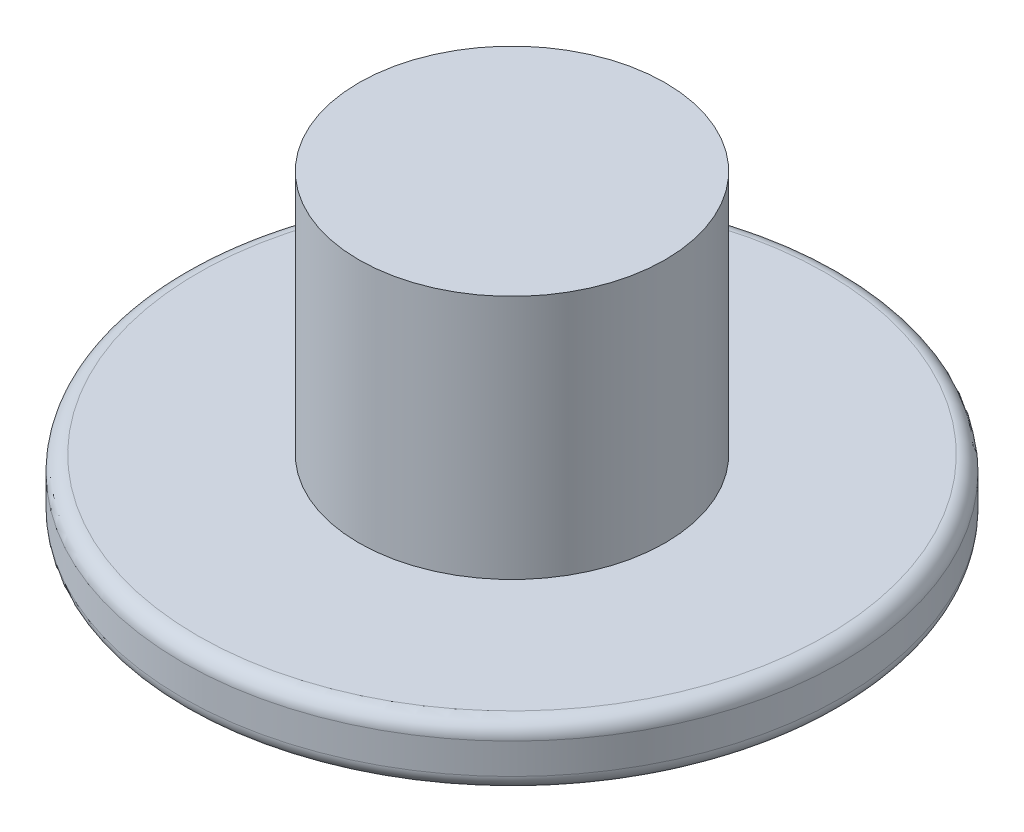
from build123d import *

# Parameters (mm, degrees)
SKETCH1_R           = 10.75
BOSS_EXTRUDE5_DEPTH = 2
SKETCH4_R           = 5
BOSS_EXTRUDE6_DEPTH = 8
CUT_EXTRUDE2_DEPTH  = 0.5
FILLET1_R           = 0.5


with BuildPart() as part:
    # Sketch1 → Boss-Extrude5 (new body)
    with BuildSketch(Plane(origin=(0, 0, 0), x_dir=(1, 0, 0), z_dir=(0, 1, 0))):
        with Locations(Location((-5.408676197, -40.3067379, 0), (0, 0, 270))):
            Circle(SKETCH1_R)
    extrude(amount=BOSS_EXTRUDE5_DEPTH)

    # Sketch4 → Boss-Extrude6 (add)
    with BuildSketch(Plane(origin=(0, 2, 0), x_dir=(1, 0, 0), z_dir=(0, 1, 0))):
        with Locations(Location((-5.408676197, -40.3067379, 0), (0, 0, 270))):
            Circle(SKETCH4_R)
    extrude(amount=BOSS_EXTRUDE6_DEPTH)

    # Sketch5 → Cut-Extrude2 (cut)
    with BuildSketch(Plane.XZ):
        with BuildLine():
            Line((-1.119213117, 44.837068706), (-1.119213117, 43.683222552))
            Line((-1.119213117, 43.683222552), (-5.343972733, 43.683222552))
            Line((-5.343972733, 43.683222552), (-6.023059271, 41.293398834))
            add(Edge.make_bspline(
                [(-6.023059271, 41.293398834), (-5.932156571, 41.326006682), (-5.748327994, 41.391948115), (-5.457355976, 41.457073381), (-5.152680183, 41.494921804), (-4.944776832, 41.500766404), (-4.83916504, 41.503735373)],
                knots=[0, 0, 0, 0, 0.957717051, 1.936749544, 2.951899637, 4, 4, 4, 4], degree=3))
            add(Edge.make_bspline(
                [(-4.83916504, 41.503735373), (-4.692794844, 41.501511705), (-4.405302434, 41.497144096), (-3.984914685, 41.449022779), (-3.584114393, 41.376035058), (-3.203409576, 41.272428706), (-2.84410494, 41.134960143), (-2.503422249, 40.970833678), (-2.183430631, 40.775504615), (-1.886735045, 40.552203964), (-1.617614167, 40.307560211), (-1.380562504, 40.046212071), (-1.18207178, 39.768708327), (-1.016586663, 39.477477761), (-0.89101931, 39.170105093), (-0.800035696, 38.848376848), (-0.744603566, 38.51220008), (-0.73796564, 38.282791456), (-0.734597733, 38.166395629)],
                knots=[0, 0, 0, 0, 1.189422793, 2.336199813, 3.434961192, 4.499048693, 5.538481089, 6.55816476, 7.569214574, 8.581065566, 9.572455183, 10.521863525, 11.44380993, 12.340676557, 13.23887286, 14.135887326, 15.054198869, 16, 16, 16, 16], degree=3))
            add(Edge.make_bspline(
                [(-0.734597733, 38.166395629), (-0.736640177, 38.085517838), (-0.740703434, 37.924618805), (-0.769785303, 37.68553966), (-0.815472566, 37.451064567), (-0.880132404, 37.220499767), (-0.964125821, 36.994808543), (-1.06783674, 36.773146693), (-1.187054465, 36.554434869), (-1.327713423, 36.342988535), (-1.484068604, 36.139863296), (-1.651274877, 35.943889885), (-1.836982388, 35.763848397), (-2.036297248, 35.595294519), (-2.247651639, 35.436933598), (-2.474538943, 35.29216457), (-2.713969847, 35.157576429), (-2.969100544, 35.038319676), (-3.234502949, 34.930569363), (-3.510180209, 34.835095329), (-3.796371201, 34.758164461), (-4.092034227, 34.694367722), (-4.396528465, 34.641310625), (-4.710907901, 34.605736687), (-5.035226874, 34.586116093), (-5.254470616, 34.582498734), (-5.366007989, 34.58065845)],
                knots=[0, 0, 0, 0, 0.892114965, 1.774781853, 2.653165494, 3.525411504, 4.413472142, 5.306650977, 6.223218553, 7.158975213, 8.104883377, 9.050131562, 9.99821726, 10.954651527, 11.928515787, 12.909348305, 13.921788707, 14.956496026, 16.013925213, 17.080882478, 18.172775305, 19.281020983, 20.417001569, 21.581128518, 22.769430922, 24, 24, 24, 24], degree=3))
            add(Edge.make_bspline(
                [(-5.366007989, 34.58065845), (-5.494284486, 34.583063858), (-5.745955956, 34.587783137), (-6.116184202, 34.622034821), (-6.47081652, 34.680178398), (-6.811266316, 34.759884514), (-7.136893236, 34.864233845), (-7.447568471, 34.992564198), (-7.743090523, 35.14314329), (-8.021755023, 35.315119606), (-8.280263283, 35.507749531), (-8.511328327, 35.723822234), (-8.717302907, 35.956398551), (-8.894124812, 36.208989698), (-9.04611222, 36.478757404), (-9.167730863, 36.768695414), (-9.263331665, 37.077407764), (-9.303738659, 37.291837918), (-9.324341322, 37.40117127)],
                knots=[0, 0, 0, 0, 1.156081109, 2.268167895, 3.347613226, 4.39280983, 5.416773159, 6.426003973, 7.419190543, 8.402904802, 9.374262051, 10.319617, 11.249247452, 12.16926304, 13.093442327, 14.034631047, 14.997900376, 16, 16, 16, 16], degree=3))
            Line((-9.324341322, 37.40117127), (-7.695735553, 37.40117127))
            add(Edge.make_bspline(
                [(-7.695735553, 37.40117127), (-7.665938842, 37.29822773), (-7.609424759, 37.102979349), (-7.494386677, 36.837131133), (-7.365578693, 36.610682144), (-7.212981365, 36.424647701), (-7.037244542, 36.271186273), (-6.837886683, 36.140033103), (-6.61753111, 36.018032238), (-6.372231072, 35.91845502), (-6.113028221, 35.8367159), (-5.84405185, 35.778976521), (-5.569406027, 35.74118536), (-5.383493923, 35.736741906), (-5.289886194, 35.734504604)],
                knots=[0, 0, 0, 0, 1.209492624, 2.293990239, 3.264217245, 4.143063212, 4.998087424, 5.889275892, 6.834373525, 7.838714582, 8.874072118, 9.900821757, 10.943052634, 12, 12, 12, 12], degree=3))
            add(Edge.make_bspline(
                [(-5.289886194, 35.734504604), (-5.192324005, 35.737130811), (-5.000016086, 35.74230741), (-4.716910345, 35.773750579), (-4.444965931, 35.830559113), (-4.183508131, 35.908770189), (-3.932477159, 36.008780442), (-3.692754799, 36.132122968), (-3.463766496, 36.276386897), (-3.249014093, 36.441955602), (-3.05146791, 36.623085173), (-2.876018465, 36.816002223), (-2.730880971, 37.023688964), (-2.609082001, 37.239620566), (-2.517761773, 37.468564453), (-2.447455886, 37.705428454), (-2.410200354, 37.954886602), (-2.40427986, 38.124220181), (-2.401264399, 38.210466142)],
                knots=[0, 0, 0, 0, 1.106657597, 2.181367805, 3.225543607, 4.253442955, 5.273050397, 6.28579989, 7.306953151, 8.338528751, 9.35692601, 10.343744444, 11.289304653, 12.224986422, 13.148978842, 14.079003922, 15.021587128, 16, 16, 16, 16], degree=3))
            add(Edge.make_bspline(
                [(-2.401264399, 38.210466142), (-2.40349869, 38.287396604), (-2.407895611, 38.438790134), (-2.444921346, 38.660709645), (-2.50534817, 38.871421278), (-2.586864736, 39.072480407), (-2.697529217, 39.259124567), (-2.828175751, 39.437781279), (-2.985412858, 39.603263585), (-3.164070316, 39.757245811), (-3.36148755, 39.89819609), (-3.579946856, 40.017155777), (-3.812244826, 40.12252931), (-4.062002973, 40.206367726), (-4.32827546, 40.270150154), (-4.610885079, 40.315501078), (-4.910695843, 40.344133926), (-5.116208444, 40.347936099), (-5.22177722, 40.349889219)],
                knots=[0, 0, 0, 0, 0.930198305, 1.830562318, 2.712659836, 3.578217842, 4.446898647, 5.330622017, 6.250663937, 7.201295639, 8.18069732, 9.178676739, 10.205529286, 11.263059576, 12.360199582, 13.514207819, 14.723085422, 16, 16, 16, 16], degree=3))
            add(Edge.make_bspline(
                [(-5.22177722, 40.349889219), (-5.313303916, 40.348222189), (-5.50398839, 40.344749139), (-5.801393829, 40.318860761), (-6.120830833, 40.278998633), (-6.462766686, 40.221835601), (-6.826240906, 40.149976218), (-7.212080245, 40.060704798), (-7.620322897, 39.957040722), (-7.898916934, 39.877831976), (-8.04229004, 39.837068706)],
                knots=[0, 0, 0, 0, 0.763917436, 1.591526851, 2.490253246, 3.450542423, 4.484603654, 5.582488234, 6.755873684, 8, 8, 8, 8], degree=3))
            Line((-8.04229004, 39.837068706), (-6.730190681, 44.837068706))
            Line((-6.730190681, 44.837068706), (-1.119213117, 44.837068706))
        make_face()
    extrude(amount=-CUT_EXTRUDE2_DEPTH, mode=Mode.SUBTRACT)

    # Fillet1
    fillet1_edges = [part.edges().sort_by_distance(p)[0] for p in [
        (-5.408676197, 0, 29.5567379),
        (-5.408676197, 2, 29.5567379),
    ]]
    fillet(fillet1_edges, radius=FILLET1_R)


solid = part.part
